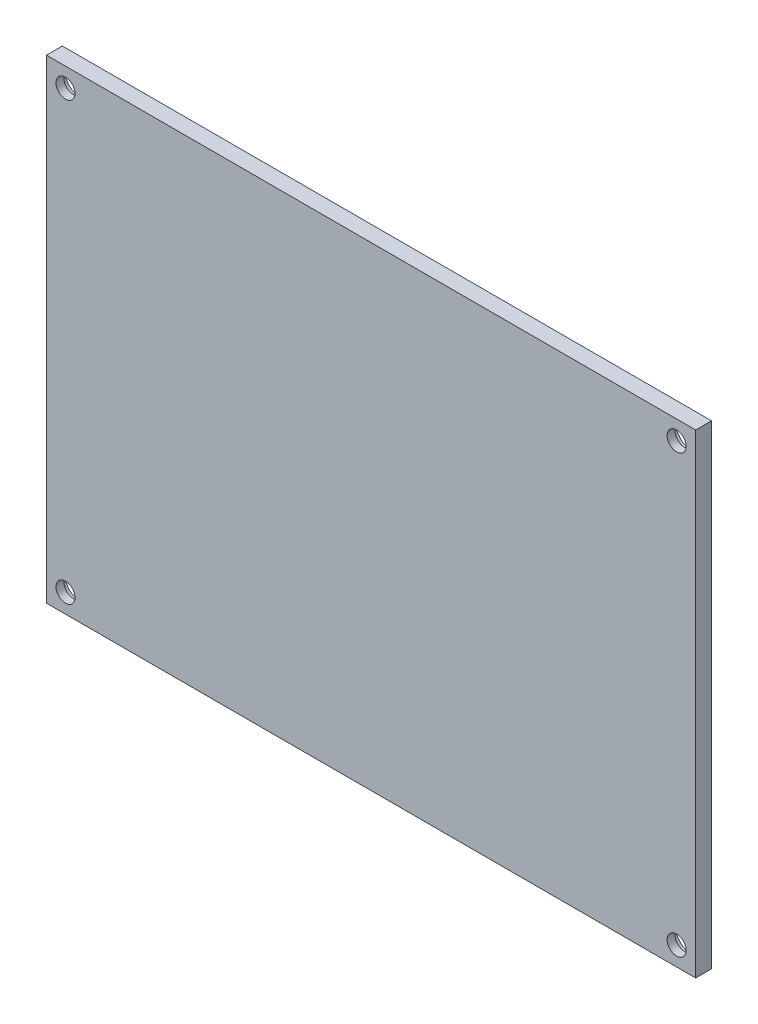
from build123d import *

# Parameters (mm, degrees)
SKETCH1_W                                        = 81.8
SKETCH1_H                                        = 59.8
BOSS_EXTRUDE1_DEPTH                              = 2
CBORE_FOR_M2_PAN_HEAD_MACHINE_SCREW1_D           = 2.4
CBORE_FOR_M2_PAN_HEAD_MACHINE_SCREW1_DEPTH       = 6
CBORE_FOR_M2_PAN_HEAD_MACHINE_SCREW1_CBORE_D     = 4.25
CBORE_FOR_M2_PAN_HEAD_MACHINE_SCREW1_CBORE_DEPTH = 1
CBORE_FOR_M2_PAN_HEAD_MACHINE_SCREW1_TIP         = 0.721032743


with BuildPart() as part:
    # Sketch1 → Boss-Extrude1 (new body)
    with BuildSketch(Plane.XY):
        with Locations((95.591153219, 3.136127214)):
            Rectangle(SKETCH1_W, SKETCH1_H)
    extrude(amount=BOSS_EXTRUDE1_DEPTH)

    # CBORE for M2 Pan Head Machine Screw1
    with Locations(Plane(origin=(0, 0, 0), x_dir=(-1, 0, 0), z_dir=(0, 0, -1))):
        with Locations((-57.091153219, 30.636127214), (-134.091153219, 30.636127214), (-57.091153219, -24.363872786), (-134.091153219, -24.363872786)):
            CounterBoreHole(CBORE_FOR_M2_PAN_HEAD_MACHINE_SCREW1_D / 2, CBORE_FOR_M2_PAN_HEAD_MACHINE_SCREW1_CBORE_D / 2, CBORE_FOR_M2_PAN_HEAD_MACHINE_SCREW1_CBORE_DEPTH, depth=CBORE_FOR_M2_PAN_HEAD_MACHINE_SCREW1_DEPTH)
            with Locations((0, 0, -(CBORE_FOR_M2_PAN_HEAD_MACHINE_SCREW1_DEPTH + CBORE_FOR_M2_PAN_HEAD_MACHINE_SCREW1_TIP / 2))):  # 118° drill point
                Cone(0, CBORE_FOR_M2_PAN_HEAD_MACHINE_SCREW1_D / 2, CBORE_FOR_M2_PAN_HEAD_MACHINE_SCREW1_TIP, mode=Mode.SUBTRACT)


solid = part.part
